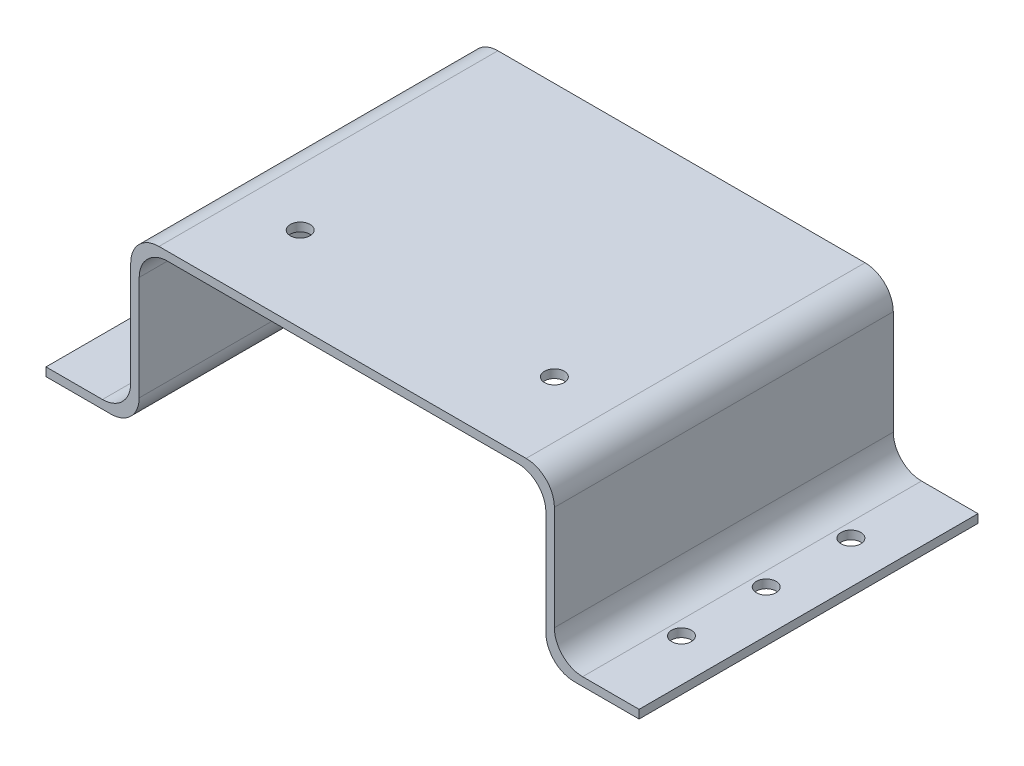
from build123d import *

# Parameters (mm, degrees)
EXTRUDE_THIN1_DEPTH = 120
SKETCH2_R           = 3.5
CUT_EXTRUDE1_DEPTH  = 10
LPATTERN1_COUNT     = 2
LPATTERN1_PITCH     = 180
SKETCH3_R           = 3.5
CUT_EXTRUDE2_DEPTH  = 10
FILLET1_R           = 10


with BuildPart() as part:
    # Sketch1 → Extrude-Thin1 (new body)
    with BuildSketch(Plane.XY):
        Polygon((30, -56.94), (0, -56.94), (0, 0), (-150, 0), (-150, -56.94), (-180, -56.94), (-180, -59.94), (-147, -59.94), (-147, -3), (-3, -3), (-3, -59.94), (30, -59.94), align=None)
    extrude(amount=-EXTRUDE_THIN1_DEPTH)

    # Sketch2 → Cut-Extrude1 (cut)
    with BuildSketch(Plane(origin=(0, -56.94, 0), x_dir=(1, 0, 0), z_dir=(0, 1, 0))):
        with Locations(Location((15, 30, 0), (0, 0, 270))):
            Circle(SKETCH2_R)
        with Locations(Location((15, 60, 0), (0, 0, 270))):
            Circle(SKETCH2_R)
        with Locations(Location((15, 90, 0), (0, 0, 270))):
            Circle(SKETCH2_R)
    cut_extrude1 = extrude(amount=-CUT_EXTRUDE1_DEPTH, mode=Mode.SUBTRACT)

    # LPattern1: Cut-Extrude1 ×2
    with Locations(*[(-i * LPATTERN1_PITCH, 0, 0) for i in range(1, LPATTERN1_COUNT)]):
        add(cut_extrude1, mode=Mode.SUBTRACT)

    # Sketch3 → Cut-Extrude2 (cut)
    with BuildSketch(Plane(origin=(0, 0, 0), x_dir=(1, 0, 0), z_dir=(0, 1, 0))):
        with Locations(Location((-30, 30, 0), (0, 0, 270))):
            Circle(SKETCH3_R)
        with Locations(Location((-120, 30, 0), (0, 0, 270))):
            Circle(SKETCH3_R)
    extrude(amount=-CUT_EXTRUDE2_DEPTH, mode=Mode.SUBTRACT)

    # Fillet1
    fillet1_edges = [part.edges().sort_by_distance(p)[0] for p in [
        (-150, -56.94, -60),
        (-150, 0, -60),
        (0, 0, -60),
        (0, -56.94, -60),
        (-3, -59.94, -60),
        (-3, -3, -60),
        (-147, -3, -60),
        (-147, -59.94, -60),
    ]]
    fillet(fillet1_edges, radius=FILLET1_R)


solid = part.part
